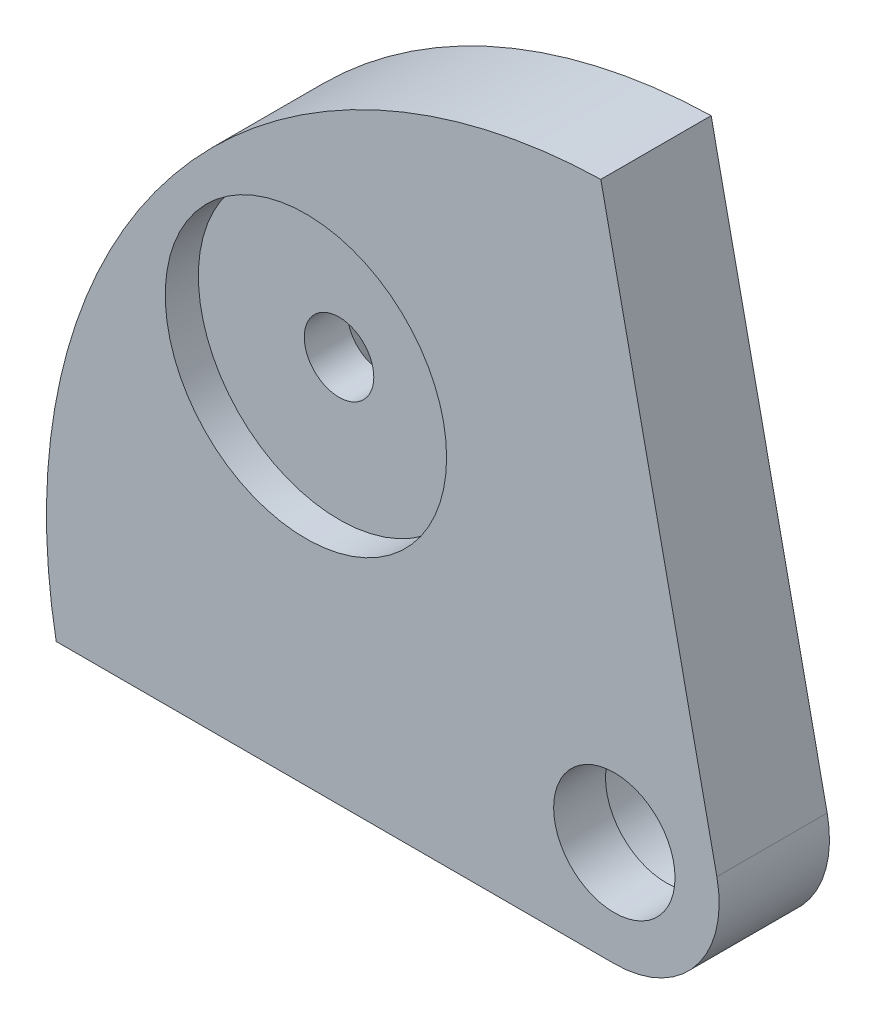
from build123d import *

# Parameters (mm, degrees)
SKETCH4_R                                            = 5.5
SKETCH4_R_2                                          = 3
BOSS_EXTRUDE2_DEPTH                                  = 10
CSK_FOR_M6_HEX_SOCKET_COUNTERSUNK_CAP_SC_D           = 6.3
CSK_FOR_M6_HEX_SOCKET_COUNTERSUNK_CAP_SC_CSINK_D     = 12.5
CSK_FOR_M6_HEX_SOCKET_COUNTERSUNK_CAP_SC_CSINK_ANGLE = 90
SKETCH7_R                                            = 6.65
CUT_EXTRUDE1_DEPTH                                   = 5.3
SKETCH8_R                                            = 12.75
CUT_EXTRUDE2_DEPTH                                   = 3


with BuildPart() as part:
    # Sketch4 → Boss-Extrude2 (new body)
    with BuildSketch(Plane.XY):
        with BuildLine():
            Line((9.292402207, 1.975161063), (-1.224202506, 51.451896246))
            ThreePointArc((-1.224202506, 51.451896246), (-39.996949985, 32.388891475), (-50.582074879, -9.5))
            Line((-50.582074879, -9.5), (0, -9.5))
            ThreePointArc((0, -9.5), (7.382886634, -5.978543715), (9.292402207, 1.975161063))
        make_face()
        Circle(SKETCH4_R, mode=Mode.SUBTRACT)
        with Locations((-27.951187583, 22.634425413)):
            Circle(SKETCH4_R_2, mode=Mode.SUBTRACT)
    extrude(amount=BOSS_EXTRUDE2_DEPTH)

    # CSK for M6 Hex Socket Countersunk Cap Screw1 (through all)
    with Locations(Plane(origin=(0, 0, 0), x_dir=(-1, 0, 0), z_dir=(0, 0, -1))):
        with Locations((27.951187583, 22.634425413)):
            CounterSinkHole(CSK_FOR_M6_HEX_SOCKET_COUNTERSUNK_CAP_SC_D / 2, CSK_FOR_M6_HEX_SOCKET_COUNTERSUNK_CAP_SC_CSINK_D / 2, counter_sink_angle=CSK_FOR_M6_HEX_SOCKET_COUNTERSUNK_CAP_SC_CSINK_ANGLE)

    # Sketch7 → Cut-Extrude1 (cut)
    with BuildSketch(Plane(origin=(0, 0, 0), x_dir=(-1, 0, 0), z_dir=(0, 0, -1))):
        Circle(SKETCH7_R)
    extrude(amount=-CUT_EXTRUDE1_DEPTH, mode=Mode.SUBTRACT)

    # Sketch8 → Cut-Extrude2 (cut)
    with BuildSketch(Plane.XY.offset(10)):
        with Locations((-27.951187583, 22.634425413)):
            Circle(SKETCH8_R)
    extrude(amount=-CUT_EXTRUDE2_DEPTH, mode=Mode.SUBTRACT)


solid = part.part
